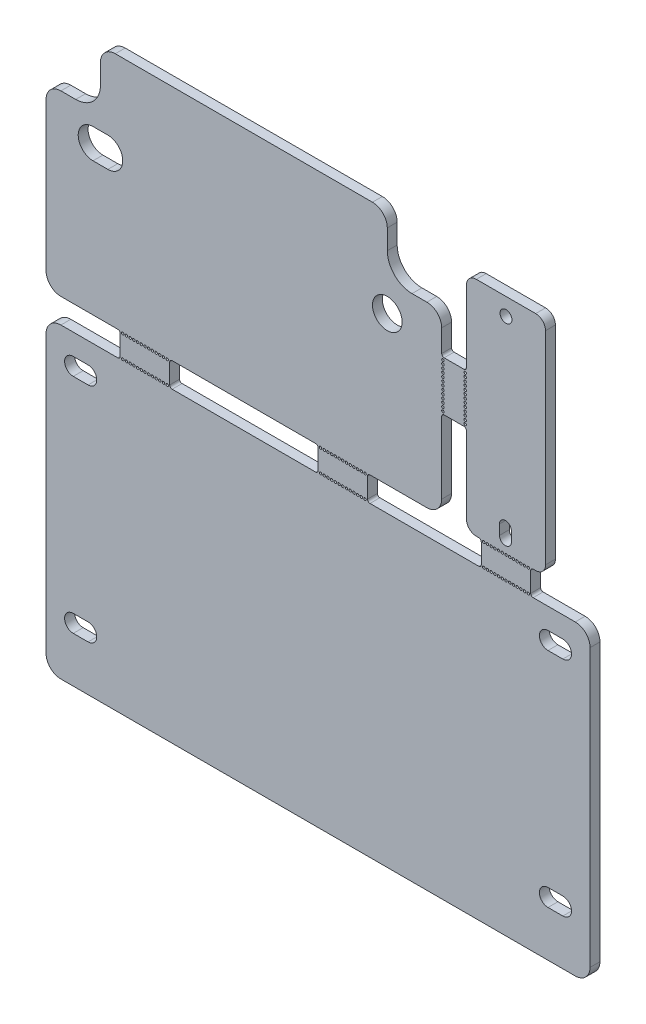
from build123d import *

# Parameters (mm, degrees)
SKETCH_1_W          = 110
SKETCH_1_H          = 65
EXTRUDE_1_DEPTH     = 2
FILLET_1_R          = 3
SKETCH_2_R          = 3
EXTRUDE_2_DEPTH     = 2
FILLET_5_R          = 3
FILLET_6_R          = 5
SKETCH_4_W          = 10
SKETCH_4_H          = 5
EXTRUDE_4_DEPTH     = 2
FILLET_7_R          = 0.5
SKETCH_5_W          = 16
SKETCH_5_H          = 45
SKETCH_5_R          = 1.2
EXTRUDE_5_DEPTH     = 2
SKETCH_6_W          = 10
SKETCH_6_H          = 5
SKETCH_6_W_2        = 5
SKETCH_6_H_2        = 10
EXTRUDE_6_DEPTH     = 2
FILLET_8_R          = 0.5
FILLET_9_R          = 2
SKETCH_7_W          = 110
SKETCH_7_H          = 3
CUT_EXTRUDE_1_DEPTH = 10
FILLET_10_R         = 3
SKETCH_8_R          = 0.25
CUT_EXTRUDE_2_DEPTH = 10
SKETCH_9_R          = 0.25
CUT_EXTRUDE_3_DEPTH = 10


with BuildPart() as part:
    # ｽｹｯﾁ1 → ﾎﾞｽ - 押し出し1 (new body)
    with BuildSketch(Plane.XY):
        Rectangle(SKETCH_1_W, SKETCH_1_H)
        with BuildLine():
            Line((-49.5, 24.75), (-46.5, 24.75))
            ThreePointArc((-46.5, 24.75), (-44.75, 26.5), (-46.5, 28.25))
            Line((-46.5, 28.25), (-49.5, 28.25))
            ThreePointArc((-49.5, 28.25), (-51.25, 26.5), (-49.5, 24.75))
        make_face(mode=Mode.SUBTRACT)
        with BuildLine():
            Line((-46.5, -20.25), (-49.5, -20.25))
            ThreePointArc((-49.5, -20.25), (-51.25, -18.5), (-49.5, -16.75))
            Line((-49.5, -16.75), (-46.5, -16.75))
            ThreePointArc((-46.5, -16.75), (-44.75, -18.5), (-46.5, -20.25))
        make_face(mode=Mode.SUBTRACT)
        with BuildLine():
            Line((46.5, -20.25), (49.5, -20.25))
            ThreePointArc((49.5, -20.25), (51.25, -18.5), (49.5, -16.75))
            Line((49.5, -16.75), (46.5, -16.75))
            ThreePointArc((46.5, -16.75), (44.75, -18.5), (46.5, -20.25))
        make_face(mode=Mode.SUBTRACT)
        with BuildLine():
            Line((46.5, 28.25), (49.5, 28.25))
            ThreePointArc((49.5, 28.25), (51.25, 26.5), (49.5, 24.75))
            Line((49.5, 24.75), (46.5, 24.75))
            ThreePointArc((46.5, 24.75), (44.75, 26.5), (46.5, 28.25))
        make_face(mode=Mode.SUBTRACT)
    extrude(amount=EXTRUDE_1_DEPTH)

    # ﾌｨﾚｯﾄ1
    fillet_1_edges = [part.edges().sort_by_distance(p)[0] for p in [
        (-55, 32.5, 1),
        (55, 32.5, 1),
    ]]
    fillet(fillet_1_edges, radius=FILLET_1_R)



with BuildPart() as body_2:
    # ｽｹｯﾁ2 → ﾎﾞｽ - 押し出し2 (new body)
    with BuildSketch(Plane.XY.offset(2)):
        Polygon((-55, 37.5), (25, 37.5), (25, 73.5), (14, 73.5), (14, 85.5), (-44, 85.5), (-44, 73.5), (-55, 73.5), align=None)
        with Locations((14, 67.5)):
            Circle(SKETCH_2_R, mode=Mode.SUBTRACT)
        with BuildLine():
            Line((-45.5, 64.5), (-42.5, 64.5))
            ThreePointArc((-42.5, 64.5), (-39.5, 67.5), (-42.5, 70.5))
            Line((-42.5, 70.5), (-45.5, 70.5))
            ThreePointArc((-45.5, 70.5), (-48.5, 67.5), (-45.5, 64.5))
        make_face(mode=Mode.SUBTRACT)
    extrude(amount=-EXTRUDE_2_DEPTH)

    # ﾌｨﾚｯﾄ5
    fillet_5_edges = [body_2.edges().sort_by_distance(p)[0] for p in [
        (25, 37.5, 1),
        (-55, 37.5, 1),
        (-55, 73.5, 1),
        (-44, 85.5, 1),
        (14, 85.5, 1),
        (25, 73.5, 1),
    ]]
    fillet(fillet_5_edges, radius=FILLET_5_R)

    # ﾌｨﾚｯﾄ6
    fillet_6_edges = [body_2.edges().sort_by_distance(p)[0] for p in [
        (-44, 73.5, 1),
        (14, 73.5, 1),
    ]]
    fillet(fillet_6_edges, radius=FILLET_6_R)


with BuildPart() as part_1:
    add(part.part)

    add(body_2.part)  # ﾎﾞｽ - 押し出し4 merges body 2
    # ｽｹｯﾁ4 → ﾎﾞｽ - 押し出し4 (add)
    with BuildSketch(Plane.XY.offset(2)):
        with Locations((-35, 35)):
            Rectangle(SKETCH_4_W, SKETCH_4_H)
        with Locations((5, 35)):
            Rectangle(SKETCH_4_W, SKETCH_4_H)
    extrude(amount=-EXTRUDE_4_DEPTH)

    # ﾌｨﾚｯﾄ7
    fillet_7_edges = [part_1.edges().sort_by_distance(p)[0] for p in [
        (0, 37.5, 1),
        (10, 37.5, 1),
        (10, 32.5, 1),
        (0, 32.5, 1),
        (-40, 37.5, 1),
        (-30, 37.5, 1),
        (-30, 32.5, 1),
        (-40, 32.5, 1),
    ]]
    fillet(fillet_7_edges, radius=FILLET_7_R)



with BuildPart() as body_2_2:
    # ｽｹｯﾁ5 → ﾎﾞｽ - 押し出し5 (new body)
    with BuildSketch(Plane.XY.offset(2)):
        with Locations((38, 60)):
            Rectangle(SKETCH_5_W, SKETCH_5_H)
        with Locations((38, 79)):
            Circle(SKETCH_5_R, mode=Mode.SUBTRACT)
        with BuildLine():
            Line((36.683223365, 42), (36.683223365, 40))
            ThreePointArc((36.683223365, 40), (37.883223365, 38.8), (39.083223365, 40))
            Line((39.083223365, 40), (39.083223365, 42))
            ThreePointArc((39.083223365, 42), (37.883223365, 43.2), (36.683223365, 42))
        make_face(mode=Mode.SUBTRACT)
    extrude(amount=-EXTRUDE_5_DEPTH)


with BuildPart() as part_2:
    add(part_1.part)

    add(body_2_2.part)  # ﾎﾞｽ - 押し出し6 merges body 2 2
    # ｽｹｯﾁ6 → ﾎﾞｽ - 押し出し6 (add)
    with BuildSketch(Plane.XY.offset(2)):
        with Locations((38, 35)):
            Rectangle(SKETCH_6_W, SKETCH_6_H)
        with Locations((27.5, 60.5)):
            Rectangle(SKETCH_6_W_2, SKETCH_6_H_2)
    extrude(amount=-EXTRUDE_6_DEPTH)

    # ﾌｨﾚｯﾄ8
    fillet_8_edges = [part_2.edges().sort_by_distance(p)[0] for p in [
        (33, 37.5, 1),
        (43, 37.5, 1),
        (43, 32.5, 1),
        (33, 32.5, 1),
        (25, 55.5, 1),
        (25, 65.5, 1),
        (30, 65.5, 1),
        (30, 55.5, 1),
    ]]
    fillet(fillet_8_edges, radius=FILLET_8_R)

    # ﾌｨﾚｯﾄ9
    fillet_9_edges = [part_2.edges().sort_by_distance(p)[0] for p in [
        (46, 37.5, 1),
        (46, 82.5, 1),
        (30, 37.5, 1),
        (30, 82.5, 1),
    ]]
    fillet(fillet_9_edges, radius=FILLET_9_R)

    # ｽｹｯﾁ7 → ｶｯﾄ - 押し出し1 (cut)
    with BuildSketch(Plane.XY.offset(2)):
        with Locations((0, -31)):
            Rectangle(SKETCH_7_W, SKETCH_7_H)
    extrude(amount=-CUT_EXTRUDE_1_DEPTH, mode=Mode.SUBTRACT)

    # ﾌｨﾚｯﾄ10
    fillet_10_edges = [part_2.edges().sort_by_distance(p)[0] for p in [
        (55, -29.5, 1),
        (-55, -29.5, 1),
    ]]
    fillet(fillet_10_edges, radius=FILLET_10_R)

    # ｽｹｯﾁ8 → ｶｯﾄ - 押し出し2 (cut)
    with BuildSketch(Plane.XY.offset(2)):
        with Locations((-39.5, 37.25)):
            Circle(SKETCH_8_R)
        with Locations((-38.75, 37.25)):
            Circle(SKETCH_8_R)
        with Locations((-38, 37.25)):
            Circle(SKETCH_8_R)
        with Locations((-37.25, 37.25)):
            Circle(SKETCH_8_R)
        with Locations((-36.5, 37.25)):
            Circle(SKETCH_8_R)
        with Locations((-35.75, 37.25)):
            Circle(SKETCH_8_R)
        with Locations((-35, 37.25)):
            Circle(SKETCH_8_R)
        with Locations((-34.25, 37.25)):
            Circle(SKETCH_8_R)
        with Locations((-33.5, 37.25)):
            Circle(SKETCH_8_R)
        with Locations((-32.75, 37.25)):
            Circle(SKETCH_8_R)
        with Locations((-32, 37.25)):
            Circle(SKETCH_8_R)
        with Locations((-31.25, 37.25)):
            Circle(SKETCH_8_R)
        with Locations((-30.5, 37.25)):
            Circle(SKETCH_8_R)
        with Locations(Location((-30.5, 32.75, 0), (0, 0, 180))):
            Circle(SKETCH_8_R)
        with Locations(Location((-31.25, 32.75, 0), (0, 0, 180))):
            Circle(SKETCH_8_R)
        with Locations(Location((-32, 32.75, 0), (0, 0, 180))):
            Circle(SKETCH_8_R)
        with Locations(Location((-32.75, 32.75, 0), (0, 0, 180))):
            Circle(SKETCH_8_R)
        with Locations(Location((-33.5, 32.75, 0), (0, 0, 180))):
            Circle(SKETCH_8_R)
        with Locations(Location((-34.25, 32.75, 0), (0, 0, 180))):
            Circle(SKETCH_8_R)
        with Locations(Location((-35, 32.75, 0), (0, 0, 180))):
            Circle(SKETCH_8_R)
        with Locations(Location((-35.75, 32.75, 0), (0, 0, 180))):
            Circle(SKETCH_8_R)
        with Locations(Location((-36.5, 32.75, 0), (0, 0, 180))):
            Circle(SKETCH_8_R)
        with Locations(Location((-37.25, 32.75, 0), (0, 0, 180))):
            Circle(SKETCH_8_R)
        with Locations(Location((-38, 32.75, 0), (0, 0, 180))):
            Circle(SKETCH_8_R)
        with Locations(Location((-38.75, 32.75, 0), (0, 0, 180))):
            Circle(SKETCH_8_R)
        with Locations(Location((-39.5, 32.75, 0), (0, 0, 180))):
            Circle(SKETCH_8_R)
        with Locations((0.5, 32.75)):
            Circle(SKETCH_8_R)
        with Locations((1.25, 32.75)):
            Circle(SKETCH_8_R)
        with Locations((2, 32.75)):
            Circle(SKETCH_8_R)
        with Locations((2.75, 32.75)):
            Circle(SKETCH_8_R)
        with Locations((3.5, 32.75)):
            Circle(SKETCH_8_R)
        with Locations((4.25, 32.75)):
            Circle(SKETCH_8_R)
        with Locations((5, 32.75)):
            Circle(SKETCH_8_R)
        with Locations((5.75, 32.75)):
            Circle(SKETCH_8_R)
        with Locations((6.5, 32.75)):
            Circle(SKETCH_8_R)
        with Locations((7.25, 32.75)):
            Circle(SKETCH_8_R)
        with Locations((8, 32.75)):
            Circle(SKETCH_8_R)
        with Locations((8.75, 32.75)):
            Circle(SKETCH_8_R)
        with Locations((9.5, 32.75)):
            Circle(SKETCH_8_R)
        with Locations(Location((0.5, 37.25, 0), (0, 0, 180))):
            Circle(SKETCH_8_R)
        with Locations(Location((1.25, 37.25, 0), (0, 0, 180))):
            Circle(SKETCH_8_R)
        with Locations(Location((2, 37.25, 0), (0, 0, 180))):
            Circle(SKETCH_8_R)
        with Locations(Location((2.75, 37.25, 0), (0, 0, 180))):
            Circle(SKETCH_8_R)
        with Locations(Location((3.5, 37.25, 0), (0, 0, 180))):
            Circle(SKETCH_8_R)
        with Locations(Location((4.25, 37.25, 0), (0, 0, 180))):
            Circle(SKETCH_8_R)
        with Locations(Location((5, 37.25, 0), (0, 0, 180))):
            Circle(SKETCH_8_R)
        with Locations(Location((5.75, 37.25, 0), (0, 0, 180))):
            Circle(SKETCH_8_R)
        with Locations(Location((6.5, 37.25, 0), (0, 0, 180))):
            Circle(SKETCH_8_R)
        with Locations(Location((7.25, 37.25, 0), (0, 0, 180))):
            Circle(SKETCH_8_R)
        with Locations(Location((8, 37.25, 0), (0, 0, 180))):
            Circle(SKETCH_8_R)
        with Locations(Location((8.75, 37.25, 0), (0, 0, 180))):
            Circle(SKETCH_8_R)
        with Locations(Location((9.5, 37.25, 0), (0, 0, 180))):
            Circle(SKETCH_8_R)
        with Locations(Location((33.5, 32.75, 0), (0, 0, 180))):
            Circle(SKETCH_8_R)
        with Locations(Location((34.25, 32.75, 0), (0, 0, 180))):
            Circle(SKETCH_8_R)
        with Locations(Location((35, 32.75, 0), (0, 0, 180))):
            Circle(SKETCH_8_R)
        with Locations(Location((35.75, 32.75, 0), (0, 0, 180))):
            Circle(SKETCH_8_R)
        with Locations(Location((36.5, 32.75, 0), (0, 0, 180))):
            Circle(SKETCH_8_R)
        with Locations(Location((37.25, 32.75, 0), (0, 0, 180))):
            Circle(SKETCH_8_R)
        with Locations(Location((38, 32.75, 0), (0, 0, 180))):
            Circle(SKETCH_8_R)
        with Locations(Location((38.75, 32.75, 0), (0, 0, 180))):
            Circle(SKETCH_8_R)
        with Locations(Location((39.5, 32.75, 0), (0, 0, 180))):
            Circle(SKETCH_8_R)
        with Locations(Location((40.25, 32.75, 0), (0, 0, 180))):
            Circle(SKETCH_8_R)
        with Locations(Location((41, 32.75, 0), (0, 0, 180))):
            Circle(SKETCH_8_R)
        with Locations(Location((41.75, 32.75, 0), (0, 0, 180))):
            Circle(SKETCH_8_R)
        with Locations(Location((42.5, 32.75, 0), (0, 0, 180))):
            Circle(SKETCH_8_R)
        with Locations((33.5, 37.25)):
            Circle(SKETCH_8_R)
        with Locations((34.25, 37.25)):
            Circle(SKETCH_8_R)
        with Locations((35, 37.25)):
            Circle(SKETCH_8_R)
        with Locations((35.75, 37.25)):
            Circle(SKETCH_8_R)
        with Locations((36.5, 37.25)):
            Circle(SKETCH_8_R)
        with Locations((37.25, 37.25)):
            Circle(SKETCH_8_R)
        with Locations((38, 37.25)):
            Circle(SKETCH_8_R)
        with Locations((38.75, 37.25)):
            Circle(SKETCH_8_R)
        with Locations((39.5, 37.25)):
            Circle(SKETCH_8_R)
        with Locations((40.25, 37.25)):
            Circle(SKETCH_8_R)
        with Locations((41, 37.25)):
            Circle(SKETCH_8_R)
        with Locations((41.75, 37.25)):
            Circle(SKETCH_8_R)
        with Locations((42.5, 37.25)):
            Circle(SKETCH_8_R)
    extrude(amount=-CUT_EXTRUDE_2_DEPTH, mode=Mode.SUBTRACT)

    # ｽｹｯﾁ9 → ｶｯﾄ - 押し出し3 (cut)
    with BuildSketch(Plane.XY.offset(2)):
        with Locations((25.25, 56)):
            Circle(SKETCH_9_R)
        with Locations((25.25, 56.75)):
            Circle(SKETCH_9_R)
        with Locations((25.25, 57.5)):
            Circle(SKETCH_9_R)
        with Locations((25.25, 58.25)):
            Circle(SKETCH_9_R)
        with Locations((25.25, 59)):
            Circle(SKETCH_9_R)
        with Locations((25.25, 59.75)):
            Circle(SKETCH_9_R)
        with Locations((25.25, 60.5)):
            Circle(SKETCH_9_R)
        with Locations((25.25, 61.25)):
            Circle(SKETCH_9_R)
        with Locations((25.25, 62)):
            Circle(SKETCH_9_R)
        with Locations((25.25, 62.75)):
            Circle(SKETCH_9_R)
        with Locations((25.25, 63.5)):
            Circle(SKETCH_9_R)
        with Locations((25.25, 64.25)):
            Circle(SKETCH_9_R)
        with Locations((25.25, 65)):
            Circle(SKETCH_9_R)
        with Locations(Location((29.75, 65, 0), (0, 0, 180))):
            Circle(SKETCH_9_R)
        with Locations(Location((29.75, 64.25, 0), (0, 0, 180))):
            Circle(SKETCH_9_R)
        with Locations(Location((29.75, 63.5, 0), (0, 0, 180))):
            Circle(SKETCH_9_R)
        with Locations(Location((29.75, 62.75, 0), (0, 0, 180))):
            Circle(SKETCH_9_R)
        with Locations(Location((29.75, 62, 0), (0, 0, 180))):
            Circle(SKETCH_9_R)
        with Locations(Location((29.75, 61.25, 0), (0, 0, 180))):
            Circle(SKETCH_9_R)
        with Locations(Location((29.75, 60.5, 0), (0, 0, 180))):
            Circle(SKETCH_9_R)
        with Locations(Location((29.75, 59.75, 0), (0, 0, 180))):
            Circle(SKETCH_9_R)
        with Locations(Location((29.75, 59, 0), (0, 0, 180))):
            Circle(SKETCH_9_R)
        with Locations(Location((29.75, 58.25, 0), (0, 0, 180))):
            Circle(SKETCH_9_R)
        with Locations(Location((29.75, 57.5, 0), (0, 0, 180))):
            Circle(SKETCH_9_R)
        with Locations(Location((29.75, 56.75, 0), (0, 0, 180))):
            Circle(SKETCH_9_R)
        with Locations(Location((29.75, 56, 0), (0, 0, 180))):
            Circle(SKETCH_9_R)
    extrude(amount=-CUT_EXTRUDE_3_DEPTH, mode=Mode.SUBTRACT)


solid = part_2.part
